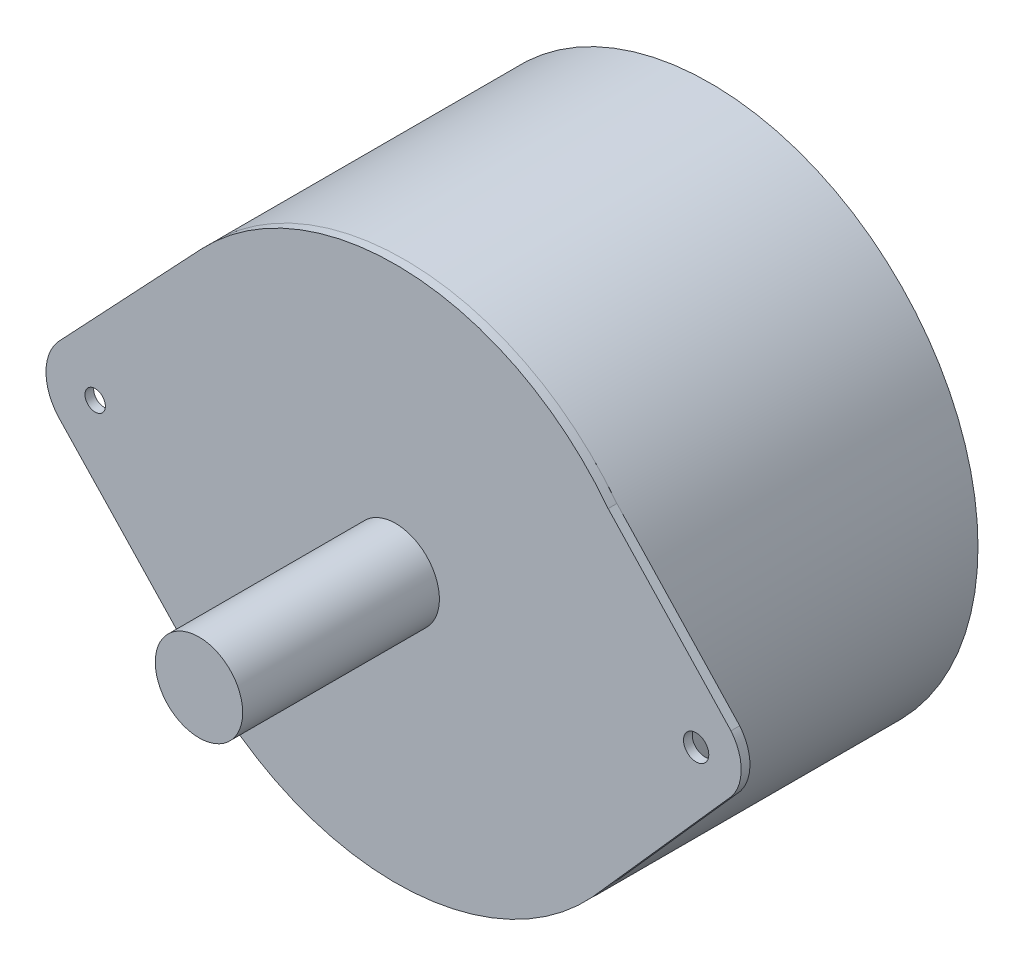
from build123d import *

# Parameters (mm, degrees)
SKETCH_1_R          = 24.5
EXTRUDE_1_DEPTH     = 28
EXTRUDE_3_DEPTH     = 0.8
SKETCH_6_R          = 0.933836341
SKETCH_6_R_2        = 1.157857081
CUT_EXTRUDE_4_DEPTH = 0.8
SKETCH_7_R          = 4
EXTRUDE_4_DEPTH     = 18


with BuildPart() as part:
    # Эскиз1 → Бобышка-Вытянуть1 (new body)
    with BuildSketch(Plane.XY):
        with Locations((-5.303851292, -8.487763012)):
            Circle(SKETCH_1_R)
    extrude(amount=EXTRUDE_1_DEPTH)


with BuildPart() as body_2:
    # Эскиз5 → Бобышка-Вытянуть3 (new body)
    with BuildSketch(Plane.XY.offset(28)):
        with BuildLine():
            Line((-36.24167132, -5.584076828), (-23.095503823, 8.355844091))
            ThreePointArc((-23.095503823, 8.355844091), (-4.02362972, 16.000645984), (14.147137789, 6.408848138))
            Line((14.147137789, 6.408848138), (25.385400671, -5.584076828))
            ThreePointArc((25.385400671, -5.584076828), (26.317981115, -8.406954521), (25.111514012, -11.124082027))
            Line((25.111514012, -11.124082027), (12.70492036, -25.099028575))
            ThreePointArc((12.70492036, -25.099028575), (-5.593800919, -32.986047222), (-23.700728785, -24.668149241))
            Line((-23.700728785, -24.668149241), (-36.146351928, -11.500683439))
            ThreePointArc((-36.146351928, -11.500683439), (-37.303267424, -8.560250781), (-36.24167132, -5.584076828))
        make_face()
    extrude(amount=EXTRUDE_3_DEPTH)

    # Эскиз6 → Вырез-Вытянуть4 (cut)
    with BuildSketch(Plane.XY.offset(28.8)):
        with Locations((-32.803851292, -8.487763012)):
            Circle(SKETCH_6_R)
        with Locations((22.199388632, -8.487763012)):
            Circle(SKETCH_6_R_2)
    extrude(amount=-CUT_EXTRUDE_4_DEPTH, mode=Mode.SUBTRACT)

    # Эскиз7 → Бобышка-Вытянуть4 (add)
    with BuildSketch(Plane.XY.offset(28.8)):
        with Locations(Location((-5.300611368, -8.487763012, 0), (0, 0, 180))):
            Circle(SKETCH_7_R)
    extrude(amount=EXTRUDE_4_DEPTH)


solid = Compound([part.part, body_2.part])
